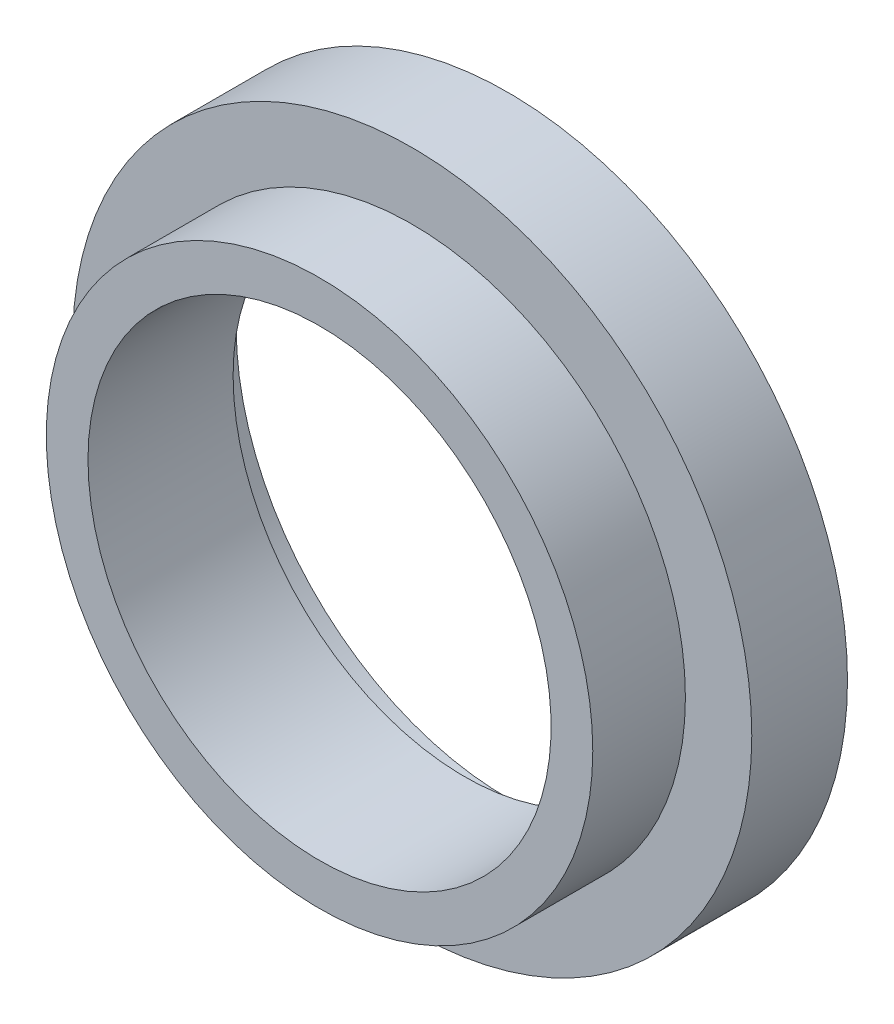
from build123d import *

# Parameters (mm, degrees)
SKETCH1_R               = 55
BOSS_EXTRUDE1_DEPTH     = 15.5
SKETCH2_R               = 44.25
BOSS_EXTRUDE2_DEPTH     = 15
SKETCH3_R               = 44
CUT_EXTRUDE1_DEPTH      = 7
CUT_EXTRUDE2_DEPTH      = 82.254230659
CUT_EXTRUDE2_DEPTH_BACK = 82.254230659
SKETCH4_R               = 37.5


with BuildPart() as part:
    # Sketch1 → Boss-Extrude1 (new body)
    with BuildSketch(Plane.XY):
        Circle(SKETCH1_R)
    extrude(amount=BOSS_EXTRUDE1_DEPTH)

    # Sketch2 → Boss-Extrude2 (add)
    with BuildSketch(Plane.XY.offset(15.5)):
        Circle(SKETCH2_R)
    extrude(amount=BOSS_EXTRUDE2_DEPTH)

    # Sketch3 → Cut-Extrude1 (cut)
    with BuildSketch(Plane(origin=(0, 0, 0), x_dir=(-1, 0, 0), z_dir=(0, 0, -1))):
        Circle(SKETCH3_R)
    extrude(amount=-CUT_EXTRUDE1_DEPTH, mode=Mode.SUBTRACT)

    # Sketch4 → Cut-Extrude2 (cut, two sides: drawn at the far end of the back side and taken through both)
    with BuildSketch(Plane(origin=(0, 0, 7), x_dir=(-1, 0, 0), z_dir=(0, 0, -1)).offset(-CUT_EXTRUDE2_DEPTH_BACK)):
        Circle(SKETCH4_R)
    extrude(amount=CUT_EXTRUDE2_DEPTH + CUT_EXTRUDE2_DEPTH_BACK, mode=Mode.SUBTRACT)


solid = part.part
